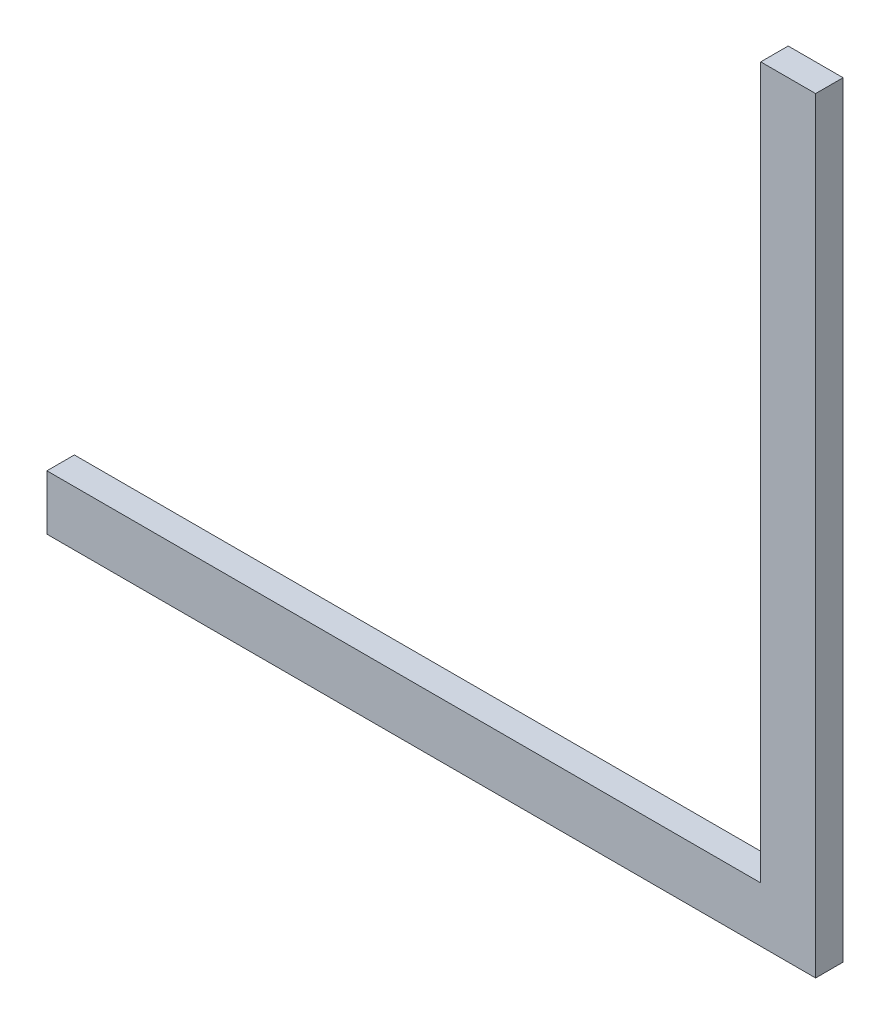
from build123d import *

# Parameters (mm, degrees)
Y_KSEKLIK_EKSTR_ZYON1_DEPTH = 1


with BuildPart() as part:
    # Çizim1 → Yükseklik-Ekstrüzyon1 (new body)
    with BuildSketch(Plane(origin=(0, 0, 0), x_dir=(0, 1, 0), z_dir=(0, 0, 1))):
        Polygon((0, 0), (0, 26), (0, 28), (2, 28), (2, 26), (2, 2), (25.9, 2), (27.9, 2), (27.9, 0), (25.9, 0), align=None)
    extrude(amount=Y_KSEKLIK_EKSTR_ZYON1_DEPTH)


solid = part.part
